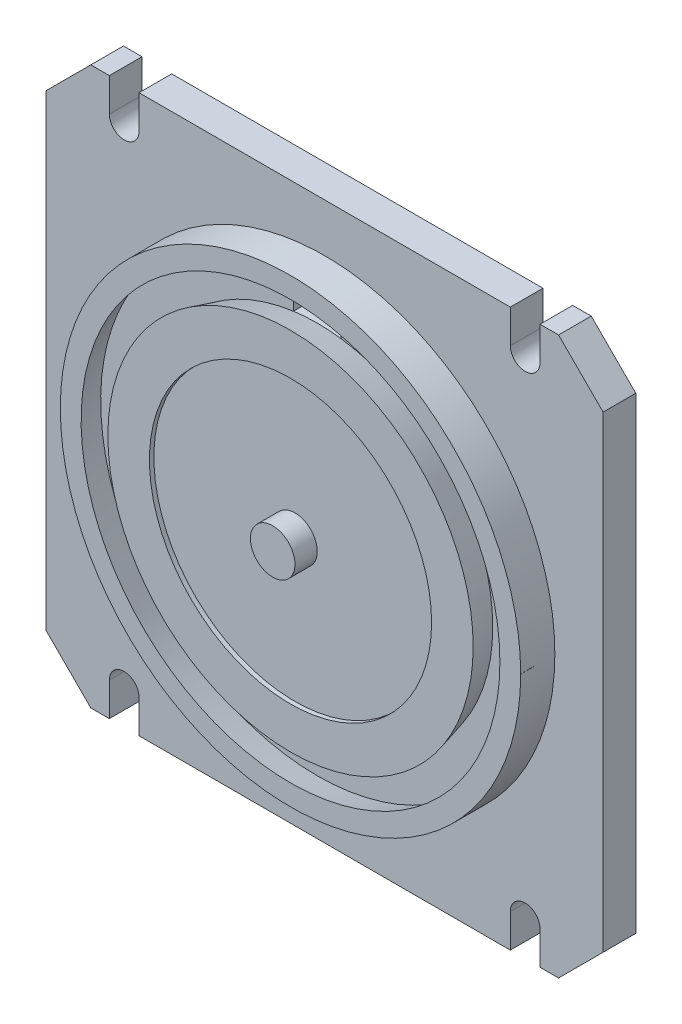
from build123d import *

# Parameters (mm, degrees)
SKETCH_1_W                                = 375
SKETCH_1_H                                = 375
EXTRUDE_1_DEPTH                           = 22
CHAMFER_1_SIZE                            = 30
CUT_EXTRUDE_1_DEPTH                       = 267.076116929
MIRROR_1_AT_THE_SECOND_PLANE_COPY_1_DEPTH = 267.076116929
SKETCH_3_R                                = 155
EXTRUDE_2_DEPTH                           = 23
SKETCH_4_R                                = 95
CUT_EXTRUDE_2_DEPTH                       = 3
SKETCH_5_R                                = 15
EXTRUDE_3_DEPTH                           = 15
CUT_EXTRUDE_3_DEPTH                       = 267.85670312
WRAP_1_SECTION_W                          = 0.2
WRAP_1_SECTION_H                          = 9
WRAP_1_ANGLE                              = 0.036965019


with BuildPart() as part:
    # 草图1 → 凸台-拉伸1 (new body)
    with BuildSketch(Plane.XY):
        Rectangle(SKETCH_1_W, SKETCH_1_H)
    extrude(amount=EXTRUDE_1_DEPTH)

    # 倒角1
    chamfer_1_edges = [part.edges().sort_by_distance(p)[0] for p in [
        (187.5, -187.5, 11),
        (-187.5, -187.5, 11),
        (-187.5, 187.5, 11),
        (187.5, 187.5, 11),
    ]]
    chamfer(chamfer_1_edges, length=CHAMFER_1_SIZE)

    # 草图2 → 切除-拉伸1 (cut, through all)
    with BuildSketch(Plane.XY.offset(22)):
        with BuildLine():
            Line((125, -187.5), (125, -165))
            ThreePointArc((125, -165), (135, -155), (145, -165))
            Line((145, -165), (145, -187.5))
            ThreePointArc((145, -187.5), (135, -197.5), (125, -187.5))
        make_face()
    cut_extrude_1 = extrude(amount=-CUT_EXTRUDE_1_DEPTH, mode=Mode.SUBTRACT)

    # 镜向1: 切除-拉伸1 across plane
    add(cut_extrude_1.mirror(Plane.ZX), mode=Mode.SUBTRACT)

    # 镜向1 at the second plane: 切除-拉伸1 across plane
    add(cut_extrude_1.mirror(Plane(origin=(0, 0, 0), x_dir=(0, 0, 1), z_dir=(1, 0, 0))), mode=Mode.SUBTRACT)

    # 镜向1 at the second plane copy 1 sket → 镜向1 at the second plane copy 1 (cut, through all)
    with BuildSketch(Plane(origin=(0, 0, 22), x_dir=(-1, 0, 0), z_dir=(0, 0, 1))):
        with BuildLine():
            Line((125, -187.5), (125, -165))
            ThreePointArc((125, -165), (135, -155), (145, -165))
            Line((145, -165), (145, -187.5))
            ThreePointArc((145, -187.5), (135, -197.5), (125, -187.5))
        make_face()
    extrude(amount=-MIRROR_1_AT_THE_SECOND_PLANE_COPY_1_DEPTH, mode=Mode.SUBTRACT)

    # 草图3 → 凸台-拉伸2 (add)
    with BuildSketch(Plane.XY.offset(22)):
        Circle(SKETCH_3_R)
    extrude(amount=EXTRUDE_2_DEPTH)

    # 草图4 → 切除-拉伸2 (cut)
    with BuildSketch(Plane.XY.offset(45)):
        Circle(SKETCH_4_R)
    extrude(amount=-CUT_EXTRUDE_2_DEPTH, mode=Mode.SUBTRACT)

    # 草图5 → 凸台-拉伸3 (add)
    with BuildSketch(Plane.XY.offset(42)):
        Circle(SKETCH_5_R)
    extrude(amount=EXTRUDE_3_DEPTH)

    # 草图6 → 切除-旋转1 (revolve, cut)
    with BuildSketch(Plane(origin=(0, 0, 0), x_dir=(0, 0, -1), z_dir=(1, 0, 0)), mode=Mode.PRIVATE) as cut_revolve_1_sk:
        Polygon((-78.588457268, -132), (-27, -118.176914536), (-27, -145.823085464), align=None)
    revolve(cut_revolve_1_sk.sketch.rotate(Axis((0, 0, 0), (0, 0, -1)), 270), axis=Axis((0, 0, 0), (0, 0, -1)), mode=Mode.SUBTRACT)

    # 草图7 → 切除-拉伸3 (cut, through all)
    with BuildSketch(Plane.XY.offset(27)):
        with BuildLine():
            Line((-16, 117.088783106), (-16, 144.942651605))
            ThreePointArc((-16, 144.942651605), (0, 145.823085464), (16, 144.942651605))
            Line((16, 144.942651605), (16, 117.088783106))
            ThreePointArc((16, 117.088783106), (0, 118.176914536), (-16, 117.088783106))
        make_face()
    extrude(amount=-CUT_EXTRUDE_3_DEPTH, mode=Mode.SUBTRACT)

    # 包覆1 section (on wrap section) → 包覆1 (revolve, cut)
    with BuildSketch(Plane(origin=(0, 0, 22), x_dir=(0.9999999479708641, 0.00032258063956674645, 0), z_dir=(-0.00032258063956674645, 0.9999999479708641, 0))):
        with Locations((154.9, -18.5)):
            Rectangle(WRAP_1_SECTION_W, WRAP_1_SECTION_H)
    wrap_1 = revolve(axis=Axis((0, 0, 22), (0, 0, -1)), revolution_arc=WRAP_1_ANGLE, mode=Mode.SUBTRACT)

    # 镜向2: 包覆1 across plane
    add(wrap_1.mirror(Plane(origin=(0, 0, 0), x_dir=(0, 0, 1), z_dir=(1, 0, 0))), mode=Mode.SUBTRACT)


solid = part.part
